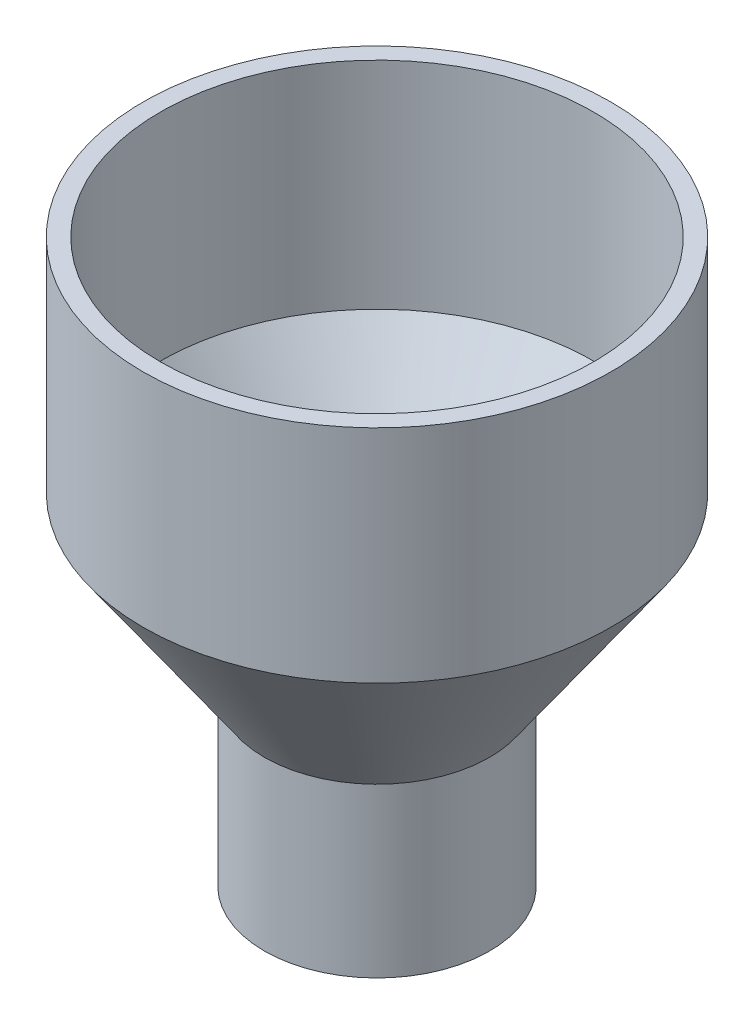
from build123d import *


with BuildPart() as part:
    # Esboço1 → Revolução2 (revolve)
    with BuildSketch(Plane.XY, mode=Mode.PRIVATE) as revolu_o2_sk:
        Polygon((-11, 0), (-13, 0), (-13, 19.369555538), (-27, 39.369555538), (-27, 64.905127939), (-25, 64.905127939), (-25, 40), (-11, 20), align=None)
    revolve(revolu_o2_sk.sketch.rotate(Axis((0, 64.905127939, 0), (0, -1, 0)), 270), axis=Axis((0, 64.905127939, 0), (0, -1, 0)))


solid = part.part
